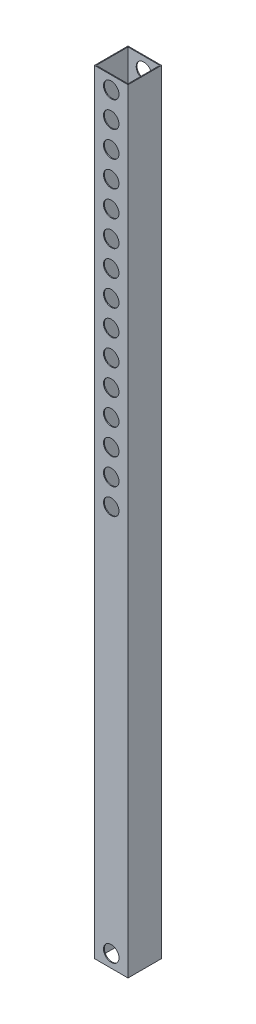
from build123d import *

# Parameters (mm, degrees)
CROQUIS1_W              = 13
CROQUIS1_H              = 13
SALIENTE_EXTRUIR1_DEPTH = 300
CROQUIS2_W              = 12.366
CROQUIS2_H              = 12.366
CORTAR_EXTRUIR1_DEPTH   = 500
CROQUIS3_R              = 3
CORTAR_EXTRUIR2_DEPTH   = 500
CROQUIS4_R              = 3
CORTAR_EXTRUIR3_DEPTH   = 500


with BuildPart() as part:
    # Croquis1 → Saliente-Extruir1 (new body)
    with BuildSketch(Plane(origin=(0, 0, 0), x_dir=(1, 0, 0), z_dir=(0, 1, 0))):
        Rectangle(CROQUIS1_W, CROQUIS1_H)
    extrude(amount=SALIENTE_EXTRUIR1_DEPTH)

    # Croquis2 → Cortar-Extruir1 (cut)
    with BuildSketch(Plane(origin=(0, 300, 0), x_dir=(1, 0, 0), z_dir=(0, 1, 0))):
        Rectangle(CROQUIS2_W, CROQUIS2_H)
    extrude(amount=-CORTAR_EXTRUIR1_DEPTH, mode=Mode.SUBTRACT)

    # Croquis3 → Cortar-Extruir2 (cut)
    with BuildSketch(Plane.XY.offset(6.5)):
        with Locations((0, 5)):
            Circle(CROQUIS3_R)
    extrude(amount=-CORTAR_EXTRUIR2_DEPTH, mode=Mode.SUBTRACT)

    # Croquis4 → Cortar-Extruir3 (cut)
    with BuildSketch(Plane.XY.offset(6.5)):
        with Locations((0, 295)):
            Circle(CROQUIS4_R)
        with Locations((0, 285)):
            Circle(CROQUIS4_R)
        with Locations((0, 275)):
            Circle(CROQUIS4_R)
        with Locations((0, 265)):
            Circle(CROQUIS4_R)
        with Locations((0, 255)):
            Circle(CROQUIS4_R)
        with Locations((0, 245)):
            Circle(CROQUIS4_R)
        with Locations((0, 235)):
            Circle(CROQUIS4_R)
        with Locations((0, 225)):
            Circle(CROQUIS4_R)
        with Locations((0, 215)):
            Circle(CROQUIS4_R)
        with Locations((0, 205)):
            Circle(CROQUIS4_R)
        with Locations((0, 195)):
            Circle(CROQUIS4_R)
        with Locations((0, 185)):
            Circle(CROQUIS4_R)
        with Locations((0, 175)):
            Circle(CROQUIS4_R)
        with Locations((0, 165)):
            Circle(CROQUIS4_R)
        with Locations((0, 155)):
            Circle(CROQUIS4_R)
    extrude(amount=-CORTAR_EXTRUIR3_DEPTH, mode=Mode.SUBTRACT)


solid = part.part
